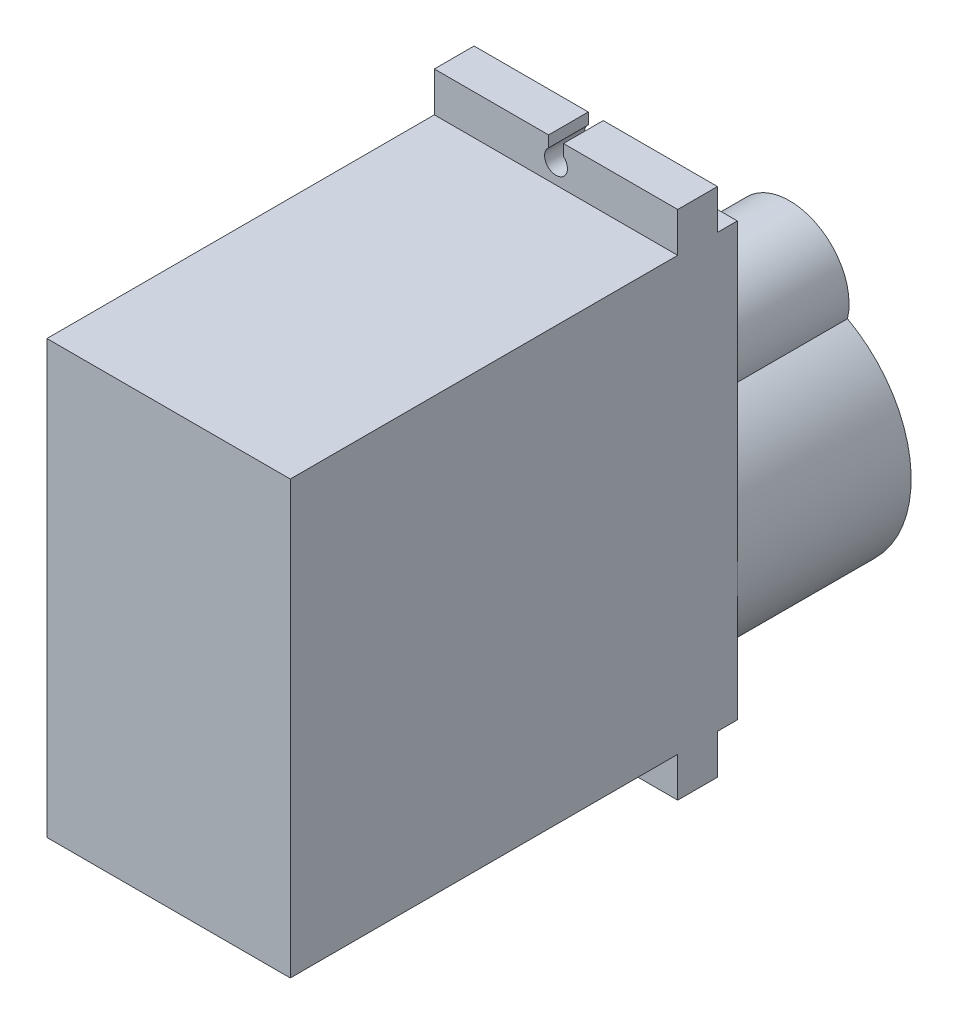
from build123d import *

# Parameters (mm, degrees)
SKETCH1_W           = 12.446
SKETCH1_H           = 22.098
BOSS_EXTRUDE1_DEPTH = 22.86
SKETCH2_W           = 12.446
SKETCH2_H           = 2.032
BOSS_EXTRUDE2_DEPTH = 2.032
CUT_EXTRUDE1_DEPTH  = 2.032
BOSS_EXTRUDE3_DEPTH = 8.89
SKETCH5_R           = 2.54
CUT_EXTRUDE2_DEPTH  = 1.27


with BuildPart() as part:
    # Sketch1 → Boss-Extrude1 (new body)
    with BuildSketch(Plane.XY):
        Rectangle(SKETCH1_W, SKETCH1_H)
    extrude(amount=BOSS_EXTRUDE1_DEPTH)

    # Sketch2 → Boss-Extrude2 (add)
    with BuildSketch(Plane(origin=(0, 11.049, 0), x_dir=(1, 0, 0), z_dir=(0, 1, 0))):
        with Locations((0, -2.032)):
            Rectangle(SKETCH2_W, SKETCH2_H)
    boss_extrude2 = extrude(amount=BOSS_EXTRUDE2_DEPTH)

    # Sketch3 → Cut-Extrude1 (cut)
    with BuildSketch(Plane(origin=(0, 0, 1.016), x_dir=(-1, 0, 0), z_dir=(0, 0, -1))):
        with BuildLine():
            Line((-0.381, 13.081), (-0.381, 12.507864133))
            ThreePointArc((-0.381, 12.507864133), (0, 11.4808), (0.381, 12.507864133))
            Line((0.381, 12.507864133), (0.381, 13.081))
            Line((0.381, 13.081), (-0.381, 13.081))
        make_face()
    cut_extrude1 = extrude(amount=-CUT_EXTRUDE1_DEPTH, mode=Mode.SUBTRACT)

    # Mirror1: Boss-Extrude2 across plane
    add(boss_extrude2.mirror(Plane.ZX))

    # Mirror2: Cut-Extrude1 across plane
    add(cut_extrude1.mirror(Plane.ZX), mode=Mode.SUBTRACT)

    # Sketch4 → Boss-Extrude3 (add)
    with BuildSketch(Plane(origin=(0, 0, 0), x_dir=(-1, 0, 0), z_dir=(0, 0, -1))):
        with BuildLine():
            ThreePointArc((-2.967141975, 0.644082038), (0, -11.049), (2.967141975, 0.644082038))
            ThreePointArc((2.967141975, 0.644082038), (0, 4.389486154), (-2.967141975, 0.644082038))
        make_face()
    extrude(amount=BOSS_EXTRUDE3_DEPTH)

    # Sketch5 → Cut-Extrude2 (cut)
    with BuildSketch(Plane(origin=(0, 0, -8.89), x_dir=(-1, 0, 0), z_dir=(0, 0, -1))):
        with Locations((0, -4.826)):
            Circle(SKETCH5_R)
    extrude(amount=-CUT_EXTRUDE2_DEPTH, mode=Mode.SUBTRACT)


solid = part.part
